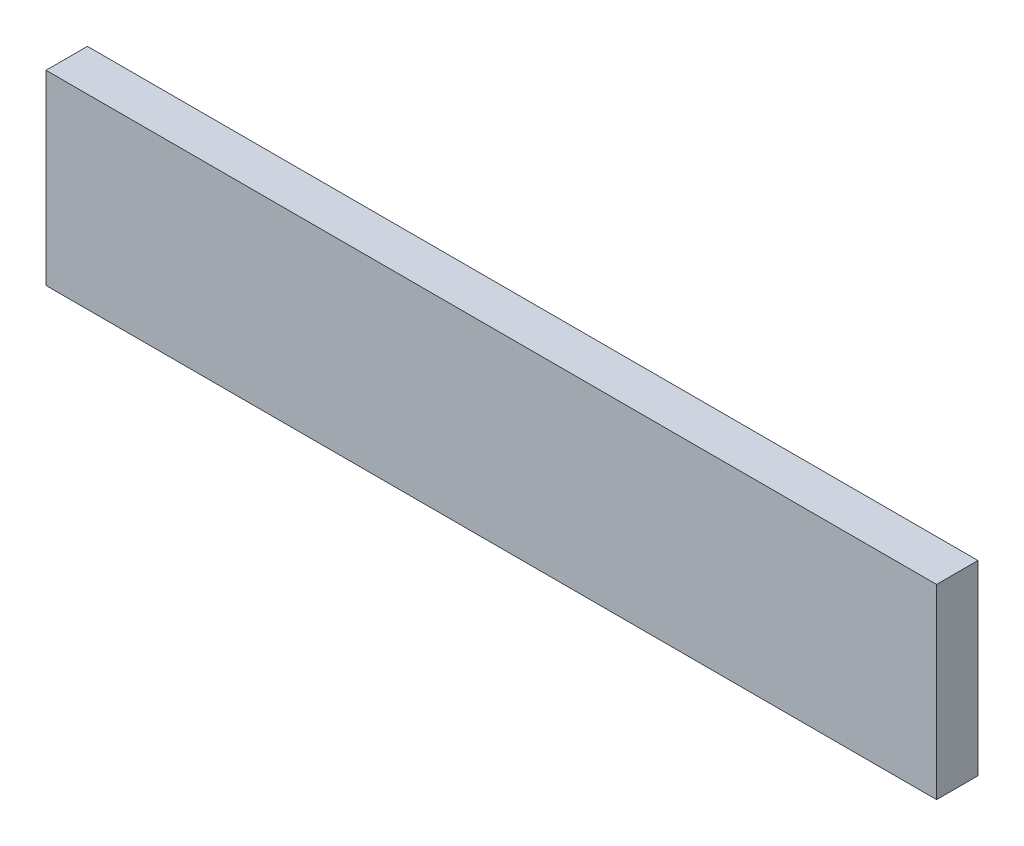
from build123d import *

# Parameters (mm, degrees)
SKETCH_1_W            = 86
SKETCH_1_H            = 18
PITCH_YOKE_BEAM_DEPTH = 4


with BuildPart() as part:
    # 草图1 → Pitch_Yoke_Beam (new body)
    with BuildSketch(Plane.XY):
        with Locations((43, 9)):
            Rectangle(SKETCH_1_W, SKETCH_1_H)
    extrude(amount=PITCH_YOKE_BEAM_DEPTH)


solid = part.part
